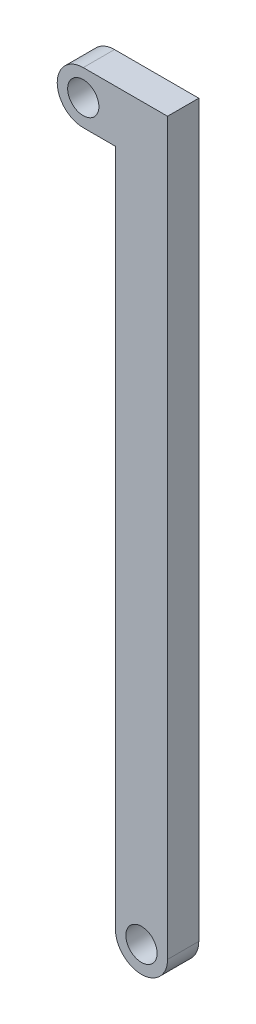
from build123d import *

# Parameters (mm, degrees)
SKETCH1_R           = 15
BOSS_EXTRUDE1_DEPTH = 30


with BuildPart() as part:
    # Sketch1 → Boss-Extrude1 (new body)
    with BuildSketch(Plane.XY):
        with BuildLine():
            Line((-119.563888889, 46.427777778), (-88.663888889, 46.427777778))
            Line((-88.663888889, 46.427777778), (-88.663888889, -604.572222222))
            ThreePointArc((-88.663888889, -604.572222222), (-63.663888889, -629.572222222), (-38.663888889, -604.572222222))
            Line((-38.663888889, -604.572222222), (-38.663888889, 96.427777778))
            Line((-38.663888889, 96.427777778), (-119.563888889, 96.427777778))
            ThreePointArc((-119.563888889, 96.427777778), (-144.563888889, 71.427777778), (-119.563888889, 46.427777778))
        make_face()
        with Locations((-119.563888889, 71.427777778)):
            Circle(SKETCH1_R, mode=Mode.SUBTRACT)
        with Locations((-63.663888889, -604.572222222)):
            Circle(SKETCH1_R, mode=Mode.SUBTRACT)
    extrude(amount=BOSS_EXTRUDE1_DEPTH)


solid = part.part
